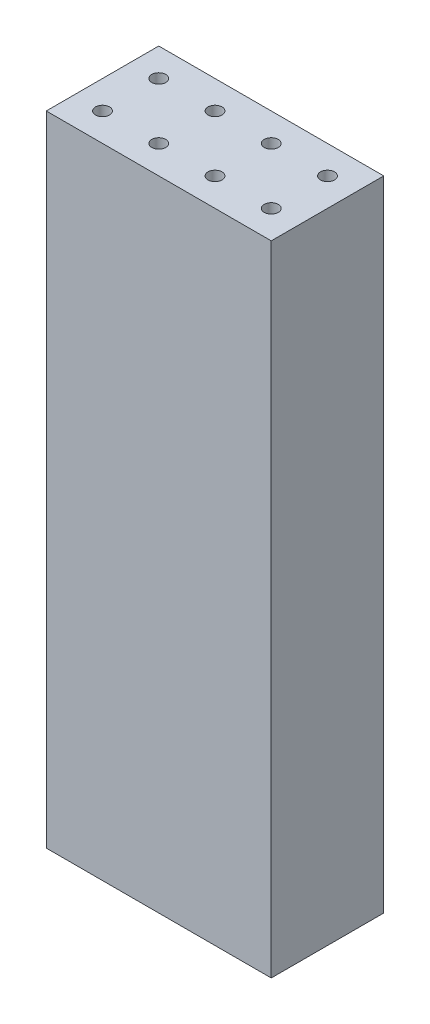
from build123d import *

# Parameters (mm, degrees)
SKETCH1_W            = 101.6
SKETCH1_H            = 50.8
BOSS_EXTRUDE1_DEPTH  = 288.29
SKETCH3_R            = 3.175
CUT_EXTRUDE1_DEPTH   = 10
LPATTERN1_COUNT      = 4
LPATTERN1_PITCH      = 25.4
LPATTERN1_COUNT_DIR2 = 2
LPATTERN1_PITCH_DIR2 = 25.4


with BuildPart() as part:
    # Sketch1 → Boss-Extrude1 (new body)
    with BuildSketch(Plane(origin=(0, 0, 0), x_dir=(1, 0, 0), z_dir=(0, 1, 0))):
        Rectangle(SKETCH1_W, SKETCH1_H)
    extrude(amount=BOSS_EXTRUDE1_DEPTH)

    # Sketch3 → Cut-Extrude1 (cut)
    with BuildSketch(Plane(origin=(0, 288.29, 0), x_dir=(1, 0, 0), z_dir=(0, 1, 0))):
        with Locations(Location((-38.1, 12.7, 0), (0, 0, 270))):
            Circle(SKETCH3_R)
    cut_extrude1 = extrude(amount=-CUT_EXTRUDE1_DEPTH, mode=Mode.SUBTRACT)

    # LPattern1: Cut-Extrude1 4 × 2
    with Locations(*[(i * LPATTERN1_PITCH, 0, j * LPATTERN1_PITCH_DIR2) for i in range(LPATTERN1_COUNT) for j in range(LPATTERN1_COUNT_DIR2) if (i, j) != (0, 0)]):
        add(cut_extrude1, mode=Mode.SUBTRACT)


solid = part.part
